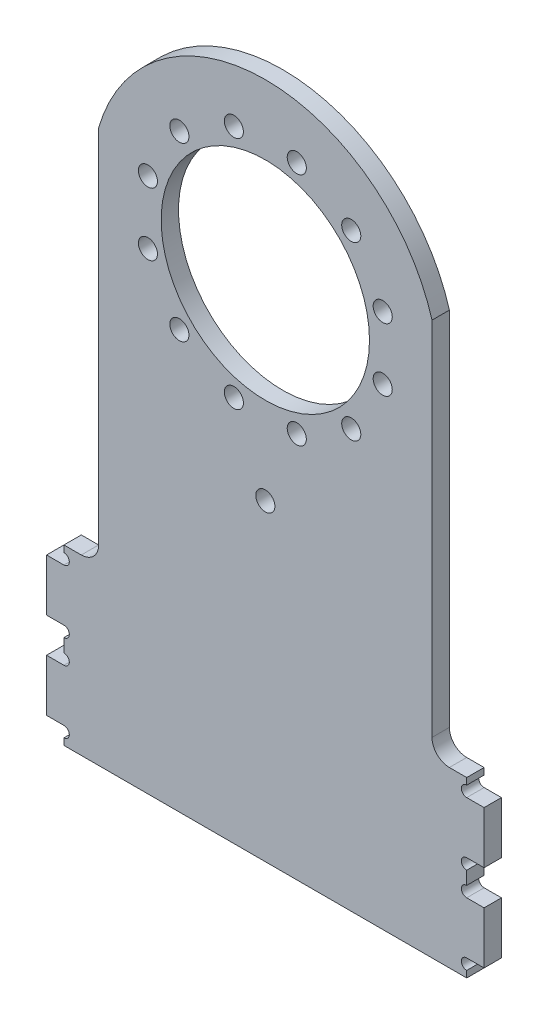
from build123d import *

# Parameters (mm, degrees)
SKETCH_1_R          = 30
EXTRUDE_1_DEPTH     = 5
SKETCH_3_R          = 2.75
CUT_EXTRUDE_2_DEPTH = 20
SKETCH_4_R          = 2.75
CUT_EXTRUDE_3_DEPTH = 10
SKETCH_5_W          = 116
SKETCH_5_H          = 50
EXTRUDE_2_DEPTH     = 5
SKETCH_8_W          = 5
SKETCH_8_H          = 15
EXTRUDE_3_DEPTH     = 5
SKETCH_9_R          = 1.55
CUT_EXTRUDE_6_DEPTH = 5
FILLET_1_R          = 5


with BuildPart() as part:
    # 草图1 → 凸台-拉伸1 (new body)
    with BuildSketch(Plane.XY):
        with BuildLine():
            Line((-48, 109.07), (-48, 0))
            Line((-48, 0), (48, 0))
            Line((48, 0), (48, 109.07))
            ThreePointArc((48, 109.07), (0, 145.07), (-48, 109.07))
        make_face()
        with Locations((0, 95.07)):
            Circle(SKETCH_1_R, mode=Mode.SUBTRACT)
    extrude(amount=EXTRUDE_1_DEPTH)

    # 草图3 → 切除-拉伸2 (cut)
    with BuildSketch(Plane.XY.offset(5)):
        with Locations((0, 40)):
            Circle(SKETCH_3_R)
    extrude(amount=-CUT_EXTRUDE_2_DEPTH, mode=Mode.SUBTRACT)

    # 草图4 → 切除-拉伸3 (cut)
    with BuildSketch(Plane.XY.offset(5)):
        with Locations((9.058666579, 128.87740392)):
            Circle(SKETCH_4_R)
        with Locations((24.748737342, 119.818737342)):
            Circle(SKETCH_4_R)
        with Locations((33.80740392, 104.128666579)):
            Circle(SKETCH_4_R)
        with Locations((33.80740392, 86.011333421)):
            Circle(SKETCH_4_R)
        with Locations((24.748737342, 70.321262658)):
            Circle(SKETCH_4_R)
        with Locations((9.058666579, 61.26259608)):
            Circle(SKETCH_4_R)
        with Locations((-9.058666579, 61.26259608)):
            Circle(SKETCH_4_R)
        with Locations((-24.748737342, 70.321262658)):
            Circle(SKETCH_4_R)
        with Locations((-33.80740392, 86.011333421)):
            Circle(SKETCH_4_R)
        with Locations((-33.80740392, 104.128666579)):
            Circle(SKETCH_4_R)
        with Locations((-24.748737342, 119.818737342)):
            Circle(SKETCH_4_R)
        with Locations((-9.058666579, 128.87740392)):
            Circle(SKETCH_4_R)
    extrude(amount=-CUT_EXTRUDE_3_DEPTH, mode=Mode.SUBTRACT)

    # 草图5 → 凸台-拉伸2 (add)
    with BuildSketch(Plane.XY.offset(5)):
        with Locations((0, -25)):
            Rectangle(SKETCH_5_W, SKETCH_5_H)
    extrude(amount=-EXTRUDE_2_DEPTH)

    # 草图8 → 凸台-拉伸3 (add)
    with BuildSketch(Plane.XY.offset(5)):
        with Locations((60.5, -12.5)):
            Rectangle(SKETCH_8_W, SKETCH_8_H)
        with Locations((60.5, -37.5)):
            Rectangle(SKETCH_8_W, SKETCH_8_H)
        with Locations((-60.5, -37.5)):
            Rectangle(SKETCH_8_W, SKETCH_8_H)
        with Locations((-60.5, -12.5)):
            Rectangle(SKETCH_8_W, SKETCH_8_H)
    extrude(amount=-EXTRUDE_3_DEPTH)

    # 草图9 → 切除-拉伸6 (cut)
    with BuildSketch(Plane.XY.offset(5)):
        with Locations((58, -3.45)):
            Circle(SKETCH_9_R)
        with Locations((58, -21.55)):
            Circle(SKETCH_9_R)
        with Locations((58, -28.45)):
            Circle(SKETCH_9_R)
        with Locations((58, -46.55)):
            Circle(SKETCH_9_R)
        with Locations((-58, -46.55)):
            Circle(SKETCH_9_R)
        with Locations((-58, -28.45)):
            Circle(SKETCH_9_R)
        with Locations((-58, -21.55)):
            Circle(SKETCH_9_R)
        with Locations((-58, -3.45)):
            Circle(SKETCH_9_R)
    extrude(amount=-CUT_EXTRUDE_6_DEPTH, mode=Mode.SUBTRACT)

    # 圆角1
    fillet_1_edges = [part.edges().sort_by_distance(p)[0] for p in [
        (48, 0, 2.5),
        (-48, 0, 2.5),
    ]]
    fillet(fillet_1_edges, radius=FILLET_1_R)


solid = part.part
